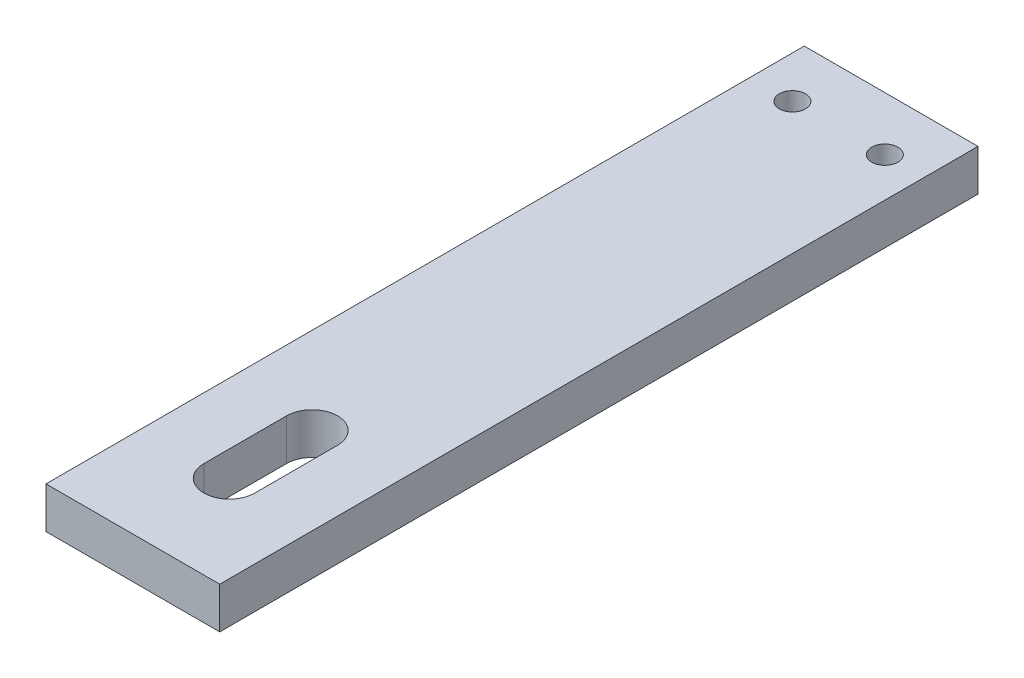
from build123d import *

# Parameters (mm, degrees)
SKETCH1_W           = 12.6
SKETCH1_H           = 55
BOSS_EXTRUDE1_DEPTH = 3
SKETCH2_R           = 0.95
CUT_EXTRUDE1_DEPTH  = 57.504513094


with BuildPart() as part:
    # Sketch1 → Boss-Extrude1 (new body)
    with BuildSketch(Plane(origin=(0, 0, 0), x_dir=(1, 0, 0), z_dir=(0, 1, 0))):
        with Locations((-6.3, 27.5)):
            Rectangle(SKETCH1_W, SKETCH1_H)
        with BuildLine():
            Line((-8.15, 7), (-8.15, 13))
            ThreePointArc((-8.15, 13), (-6.3, 14.85), (-4.45, 13))
            Line((-4.45, 13), (-4.45, 7))
            ThreePointArc((-4.45, 7), (-6.3, 5.15), (-8.15, 7))
        make_face(mode=Mode.SUBTRACT)
    extrude(amount=BOSS_EXTRUDE1_DEPTH)

    # Sketch2 → Cut-Extrude1 (cut, through all)
    with BuildSketch(Plane.XZ):
        with Locations(Location((-2.86, -51.1, 0), (0, 0, 270))):
            Circle(SKETCH2_R)
        with Locations(Location((-9.56, -51.1, 0), (0, 0, 270))):
            Circle(SKETCH2_R)
    extrude(amount=-CUT_EXTRUDE1_DEPTH, mode=Mode.SUBTRACT)


solid = part.part
